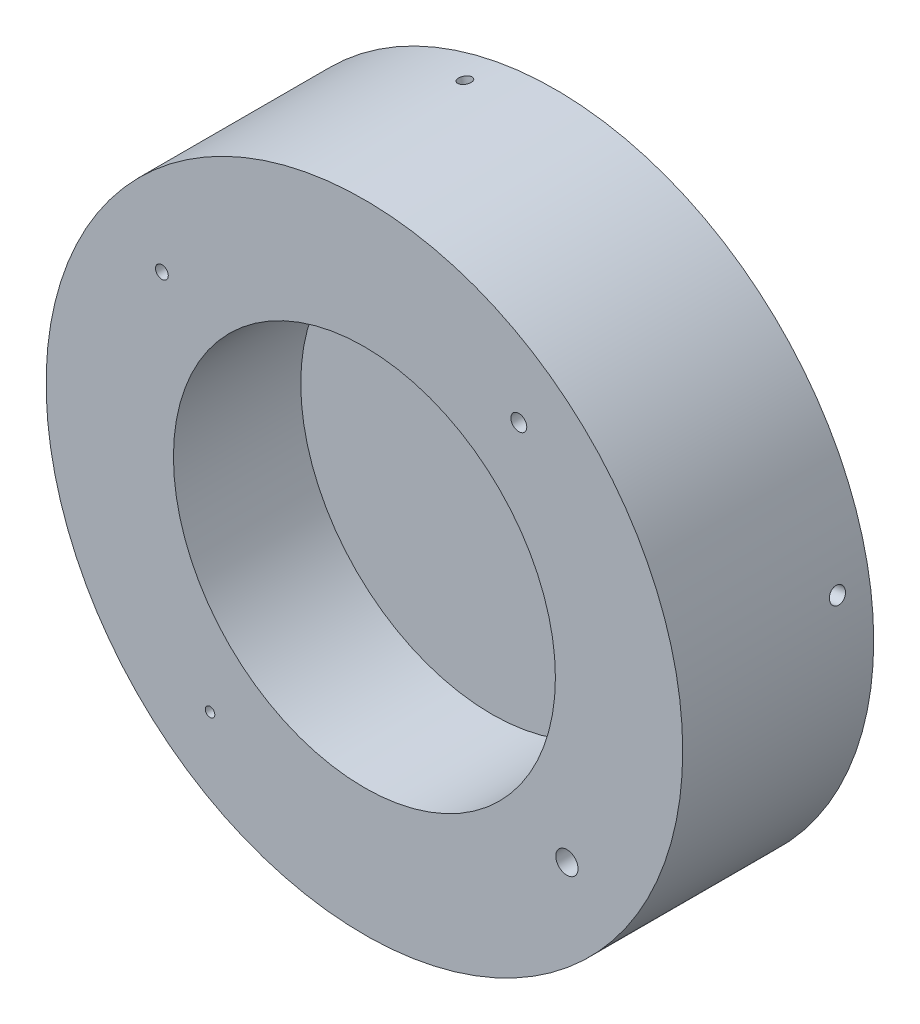
from build123d import *

# Parameters (mm, degrees)
SKIZZE1_R                            = 50
AUFSATZ_LINEAR_AUSTRAGEN1_DEPTH      = 30
SKIZZE2_R                            = 30
SCHNITT_LINEAR_AUSTRAGEN1_DEPTH      = 20
F_3_5_3_5_DURCHMESSER_BOHRUNG1_D     = 3.5
F_3_5_3_5_DURCHMESSER_BOHRUNG1_DEPTH = 40
F_3_5_3_5_DURCHMESSER_BOHRUNG1_TIP   = 1.051506083
F_2_5_2_5_DURCHMESSER_BOHRUNG1_D     = 2.5
F_2_5_2_5_DURCHMESSER_BOHRUNG1_DEPTH = 40
F_2_5_2_5_DURCHMESSER_BOHRUNG1_TIP   = 0.751075774
F_2_0_2_DURCHMESSER_BOHRUNG1_D       = 2
F_2_0_2_DURCHMESSER_BOHRUNG1_DEPTH   = 40
F_2_0_2_DURCHMESSER_BOHRUNG1_TIP     = 0.600860619
F_1_5_1_5_DURCHMESSER_BOHRUNG1_D     = 1.5
F_1_5_1_5_DURCHMESSER_BOHRUNG1_DEPTH = 40
F_1_5_1_5_DURCHMESSER_BOHRUNG1_TIP   = 0.450645464
F_3_5_3_5_DURCHMESSER_BOHRUNG2_D     = 3.5
F_2_5_2_5_DURCHMESSER_BOHRUNG2_D     = 2.5
F_2_0_2_DURCHMESSER_BOHRUNG2_D       = 2
F_1_5_1_5_DURCHMESSER_BOHRUNG3_D     = 1.5


with BuildPart() as part:
    # Skizze1 → Aufsatz-Linear austragen1 (new body)
    with BuildSketch(Plane.XY):
        Circle(SKIZZE1_R)
    extrude(amount=AUFSATZ_LINEAR_AUSTRAGEN1_DEPTH)

    # Skizze2 → Schnitt-Linear austragen1 (cut)
    with BuildSketch(Plane.XY.offset(30)):
        Circle(SKIZZE2_R)
    extrude(amount=-SCHNITT_LINEAR_AUSTRAGEN1_DEPTH, mode=Mode.SUBTRACT)

    # Ø3.5 (3.5) Durchmesser Bohrung1
    with Locations(Plane(origin=(9.764219033, -49.037332989, 5), x_dir=(-0.980746659782, -0.195284380652, 0), z_dir=(0.195284380652, -0.980746659782, 0))):
        with Locations((0, 0)):
            Hole(F_3_5_3_5_DURCHMESSER_BOHRUNG1_D / 2, depth=F_3_5_3_5_DURCHMESSER_BOHRUNG1_DEPTH)
            with Locations((0, 0, -(F_3_5_3_5_DURCHMESSER_BOHRUNG1_DEPTH + F_3_5_3_5_DURCHMESSER_BOHRUNG1_TIP / 2))):  # 118° drill point
                Cone(0, F_3_5_3_5_DURCHMESSER_BOHRUNG1_D / 2, F_3_5_3_5_DURCHMESSER_BOHRUNG1_TIP, mode=Mode.SUBTRACT)

    # Ø2.5 (2.5) Durchmesser Bohrung1
    with Locations(Plane(origin=(49.30181814, 8.326507554, 5), x_dir=(-0.166530151078, 0.986036362809, 0), z_dir=(0.986036362809, 0.166530151078, 0))):
        with Locations((0, 0)):
            Hole(F_2_5_2_5_DURCHMESSER_BOHRUNG1_D / 2, depth=F_2_5_2_5_DURCHMESSER_BOHRUNG1_DEPTH)
            with Locations((0, 0, -(F_2_5_2_5_DURCHMESSER_BOHRUNG1_DEPTH + F_2_5_2_5_DURCHMESSER_BOHRUNG1_TIP / 2))):  # 118° drill point
                Cone(0, F_2_5_2_5_DURCHMESSER_BOHRUNG1_D / 2, F_2_5_2_5_DURCHMESSER_BOHRUNG1_TIP, mode=Mode.SUBTRACT)

    # Ø2.0 (2) Durchmesser Bohrung1
    with Locations(Plane(origin=(-9.221972092, 49.142193996, 5), x_dir=(0.982843879919, 0.184439441837, 0), z_dir=(-0.184439441837, 0.982843879919, 0))):
        with Locations((0, 0)):
            Hole(F_2_0_2_DURCHMESSER_BOHRUNG1_D / 2, depth=F_2_0_2_DURCHMESSER_BOHRUNG1_DEPTH)
            with Locations((0, 0, -(F_2_0_2_DURCHMESSER_BOHRUNG1_DEPTH + F_2_0_2_DURCHMESSER_BOHRUNG1_TIP / 2))):  # 118° drill point
                Cone(0, F_2_0_2_DURCHMESSER_BOHRUNG1_D / 2, F_2_0_2_DURCHMESSER_BOHRUNG1_TIP, mode=Mode.SUBTRACT)

    # Ø1.5 (1.5) Durchmesser Bohrung1
    with Locations(Plane(origin=(-48.958569775, -10.151770565, 5), x_dir=(0.203035411308, -0.979171395495, 0), z_dir=(-0.979171395495, -0.203035411308, 0))):
        with Locations((0, 0)):
            Hole(F_1_5_1_5_DURCHMESSER_BOHRUNG1_D / 2, depth=F_1_5_1_5_DURCHMESSER_BOHRUNG1_DEPTH)
            with Locations((0, 0, -(F_1_5_1_5_DURCHMESSER_BOHRUNG1_DEPTH + F_1_5_1_5_DURCHMESSER_BOHRUNG1_TIP / 2))):  # 118° drill point
                Cone(0, F_1_5_1_5_DURCHMESSER_BOHRUNG1_D / 2, F_1_5_1_5_DURCHMESSER_BOHRUNG1_TIP, mode=Mode.SUBTRACT)

    # Ø3.5 (3.5) Durchmesser Bohrung2 (through all)
    with Locations(Plane.XY.offset(30)):
        with Locations((31.806649029, -24.255660732)):
            Hole(F_3_5_3_5_DURCHMESSER_BOHRUNG2_D / 2)

    # Ø2.5 (2.5) Durchmesser Bohrung2 (through all)
    with Locations(Plane.XY.offset(30)):
        with Locations((24.254021663, 31.807898911)):
            Hole(F_2_5_2_5_DURCHMESSER_BOHRUNG2_D / 2)

    # Ø2.0 (2) Durchmesser Bohrung2 (through all)
    with Locations(Plane.XY.offset(30)):
        with Locations((-31.809148709, 24.25238253)):
            Hole(F_2_0_2_DURCHMESSER_BOHRUNG2_D / 2)

    # Ø1.5 (1.5) Durchmesser Bohrung3 (through all)
    with Locations(Plane.XY.offset(30)):
        with Locations((-24.250743333, -31.810398422)):
            Hole(F_1_5_1_5_DURCHMESSER_BOHRUNG3_D / 2)


solid = part.part
